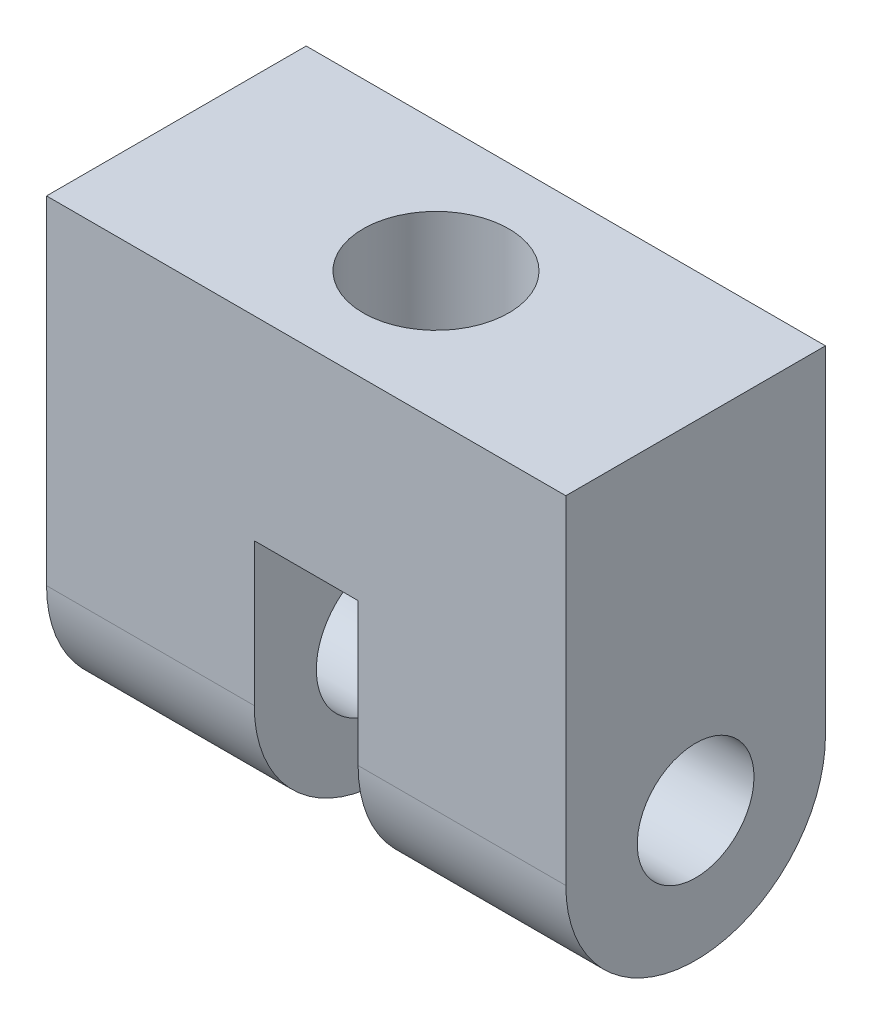
from build123d import *

# Parameters (mm, degrees)
SKETCH1_W                       = 20
SKETCH1_H                       = 10
BOSS_EXTRUDE1_DEPTH             = 18
CUT_EXTRUDE1_DEPTH              = 22.1896201
CUT_EXTRUDE1_DEPTH_BACK         = 22.1896201
SKETCH2_W                       = 4
SKETCH2_H                       = 10.5
F_16_0_177_DIAMETER_HOLE1_D     = 4.4958
F_16_0_177_DIAMETER_HOLE1_DEPTH = 8
SKETCH6_W                       = 2.60985
SKETCH6_H                       = 8
F_2_0_221_DIAMETER_HOLE1_D      = 5.6134
F_2_0_221_DIAMETER_HOLE1_DEPTH  = 8.128
F_2_0_221_DIAMETER_HOLE1_TIP    = 1.686435499
FILLET2_RADIUS                  = 5
FILLET2_LENGTH                  = 8
FILLET3_RADIUS                  = 5
FILLET3_LENGTH                  = 8


with BuildPart() as part:
    # Sketch1 → Boss-Extrude1 (new body)
    with BuildSketch(Plane(origin=(0, 0, 0), x_dir=(1, 0, 0), z_dir=(0, 1, 0))):
        Rectangle(SKETCH1_W, SKETCH1_H)
    extrude(amount=BOSS_EXTRUDE1_DEPTH)

    # Sketch2 → Cut-Extrude1 (cut, two sides: drawn at the far end of the back side and taken through both)
    with BuildSketch(Plane.XY.offset(-CUT_EXTRUDE1_DEPTH_BACK)):
        with Locations((0, 5.25)):
            Rectangle(SKETCH2_W, SKETCH2_H)
    extrude(amount=CUT_EXTRUDE1_DEPTH + CUT_EXTRUDE1_DEPTH_BACK, mode=Mode.SUBTRACT)

    # #16 (0.177) Diameter Hole1
    with Locations(Plane(origin=(10, 0, 0), x_dir=(0, 0, -1), z_dir=(1, 0, 0))):
        with Locations((0, 5)):
            Hole(F_16_0_177_DIAMETER_HOLE1_D / 2, depth=F_16_0_177_DIAMETER_HOLE1_DEPTH)

    # Sketch6 → #5 (0.2055) Diameter Hole1 (revolve, cut)
    with BuildSketch(Plane(origin=(-2, 5, 0), x_dir=(0, 0, -1), z_dir=(0, 1, 0))):
        with Locations((1.304925, 4)):
            Rectangle(SKETCH6_W, SKETCH6_H)
    revolve(axis=Axis((4.35, 5, 0), (-1, 0, 0)), mode=Mode.SUBTRACT)

    # #2 (0.221) Diameter Hole1
    with Locations(Plane(origin=(0, 18, 0), x_dir=(1, 0, 0), z_dir=(0, 1, 0))):
        with Locations((0, 0)):
            Hole(F_2_0_221_DIAMETER_HOLE1_D / 2, depth=F_2_0_221_DIAMETER_HOLE1_DEPTH)
            with Locations((0, 0, -(F_2_0_221_DIAMETER_HOLE1_DEPTH + F_2_0_221_DIAMETER_HOLE1_TIP / 2))):  # 118° drill point
                Cone(0, F_2_0_221_DIAMETER_HOLE1_D / 2, F_2_0_221_DIAMETER_HOLE1_TIP, mode=Mode.SUBTRACT)

    # Fillet2: full round fillet: the end face becomes a half cylinder, R = half its width
    fillet2_face = Plane((-6, 0, 0), x_dir=(1, 0, 0), z_dir=(0, -1, 0))  # on the end face: x along it, z out of the body
    fillet2_slab = fillet2_face.offset(-FILLET2_RADIUS / 2) * Box(FILLET2_LENGTH, 2 * FILLET2_RADIUS, FILLET2_RADIUS, mode=Mode.PRIVATE)  # the body's end, R deep
    fillet2_round = Plane((-6, 5, 0), x_dir=(0, -1, 0), z_dir=(1, 0, 0)) * Cylinder(FILLET2_RADIUS, FILLET2_LENGTH, mode=Mode.PRIVATE)  # its axis R under the face
    add(fillet2_slab - fillet2_round, mode=Mode.SUBTRACT)

    # Fillet3: full round fillet: the end face becomes a half cylinder, R = half its width
    fillet3_face = Plane((6, 0, 0), x_dir=(-1, 0, 0), z_dir=(0, -1, 0))  # on the end face: x along it, z out of the body
    fillet3_slab = fillet3_face.offset(-FILLET3_RADIUS / 2) * Box(FILLET3_LENGTH, 2 * FILLET3_RADIUS, FILLET3_RADIUS, mode=Mode.PRIVATE)  # the body's end, R deep
    fillet3_round = Plane((6, 5, 0), x_dir=(0, -1, 0), z_dir=(-1, 0, 0)) * Cylinder(FILLET3_RADIUS, FILLET3_LENGTH, mode=Mode.PRIVATE)  # its axis R under the face
    add(fillet3_slab - fillet3_round, mode=Mode.SUBTRACT)


solid = part.part
